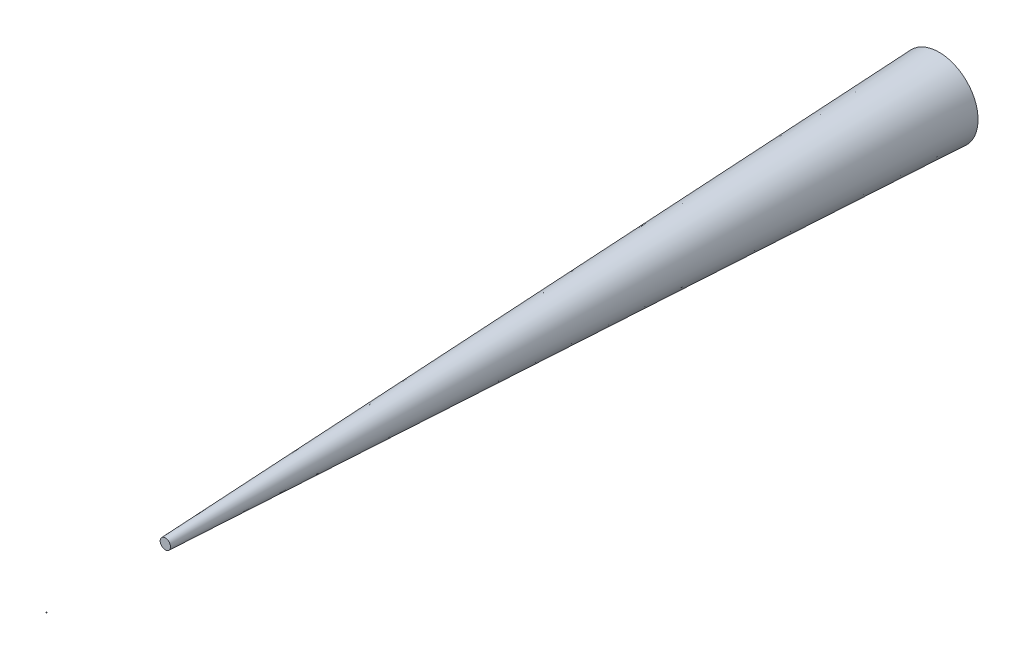
from build123d import *

# Parameters (mm, degrees)
CUT_EXTRUDE1_DEPTH      = 1503.856696665
CUT_EXTRUDE1_DEPTH_BACK = 1503.856696665
SKETCH4_W               = 1
SKETCH4_H               = 1
BOSS_EXTRUDE1_DEPTH     = 1


with BuildPart() as part:
    # Sketch1 → Revolve1 (revolve)
    with BuildSketch(Plane(origin=(0, 0, 0), x_dir=(1, 0, 0), z_dir=(0, 1, 0)), mode=Mode.PRIVATE) as revolve1_sk:
        Polygon((0, 0), (0, 1500), (65.491414363, 1500), align=None)
    revolve(revolve1_sk.sketch.rotate(Axis((0, 0, 0), (0, 0, -1)), 180), axis=Axis((0, 0, 0), (0, 0, -1)))

    # Sketch2 → Cut-Extrude1 (cut, two sides: drawn at the far end of the back side and taken through both)
    with BuildSketch(Plane(origin=(0, 0, 0), x_dir=(0, 0, -1), z_dir=(1, 0, 0)).offset(-CUT_EXTRUDE1_DEPTH_BACK)):
        Polygon((0, 0), (200, -8.732188582), (200, 8.732188582), align=None)
    extrude(amount=CUT_EXTRUDE1_DEPTH + CUT_EXTRUDE1_DEPTH_BACK, mode=Mode.SUBTRACT)


with BuildPart() as body_2:
    # Sketch4 → Boss-Extrude1 (new body)
    with BuildSketch(Plane.XY):
        Rectangle(SKETCH4_W, SKETCH4_H)
    extrude(amount=-BOSS_EXTRUDE1_DEPTH)


solid = Compound([part.part, body_2.part])
